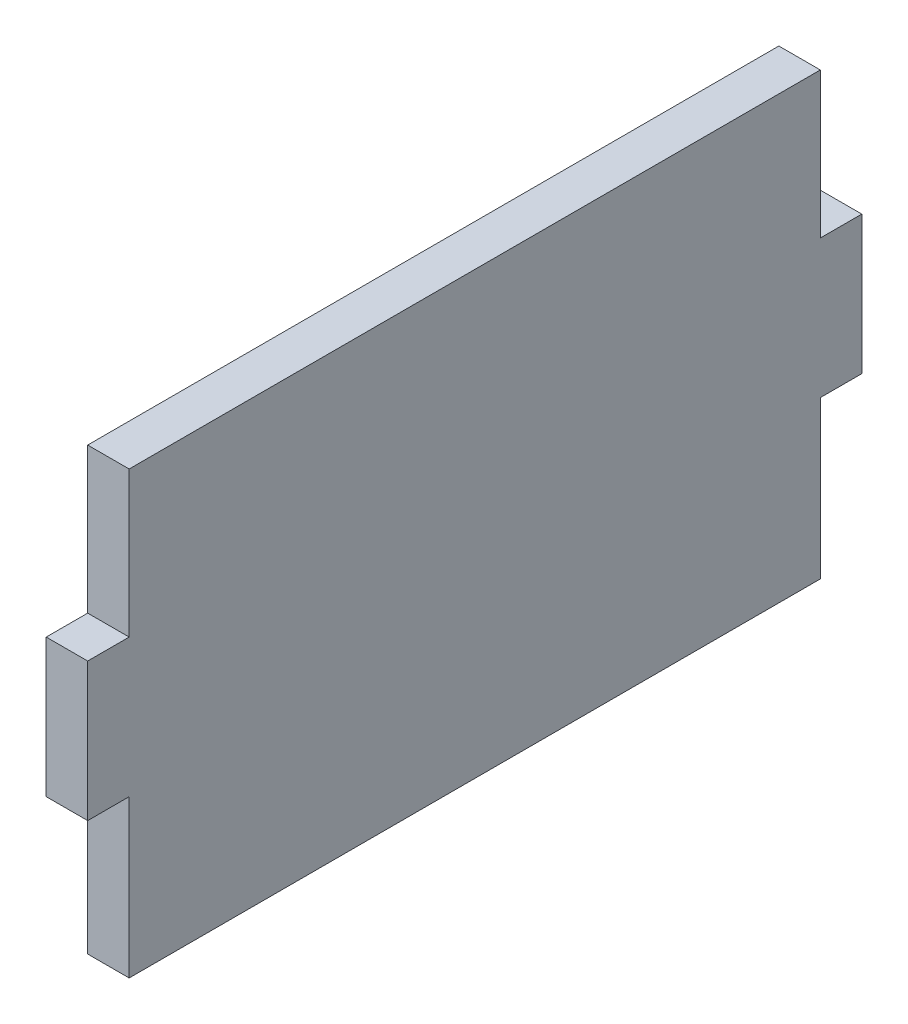
from build123d import *

# Parameters (mm, degrees)
BOSS_EXTRUDE1_DEPTH = 3


with BuildPart() as part:
    # Sketch2 → Boss-Extrude1 (new body)
    with BuildSketch(Plane(origin=(0, 0, 0), x_dir=(0, 0, -1), z_dir=(1, 0, 0))):
        Polygon((0, 0), (50, 0), (50, 11.36), (53, 11.36), (53, 21.36), (50, 21.36), (50, 31.89), (0, 31.89), (0, 21.36), (-3, 21.36), (-3, 11.36), (0, 11.36), align=None)
    extrude(amount=BOSS_EXTRUDE1_DEPTH)


solid = part.part
